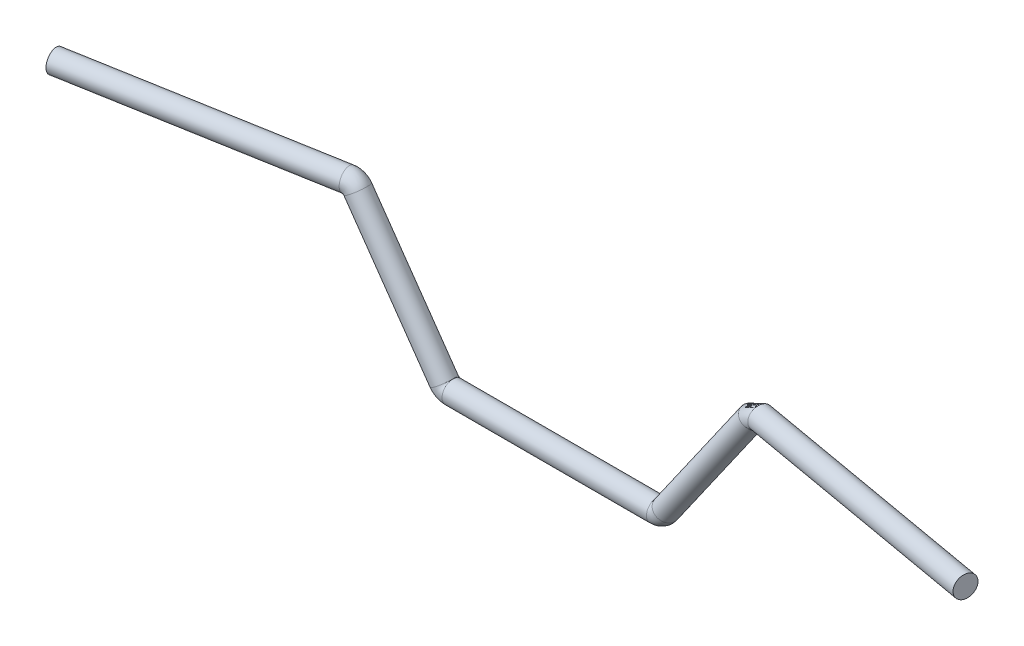
from build123d import *

# Parameters (mm, degrees)
SWEEP4_PROFILE_R = 10


with BuildPart() as part:
    # Sweep4: sweep along a curve in space
    with BuildLine() as sweep4_path:
        Line((191.229564546, 122.872806643, 0.915683484), (422.390326176, 122.872806643, 41.67556264))
        ThreePointArc((183.011875869, 118.553245059, 0), (186.611803821, 121.726761627, 0.242944677), (191.229564546, 122.872806643, 0.915683484))
        Line((102.985849937, 4.264235636, 0), (183.011875869, 118.553245059, 0))
        ThreePointArc((102.985849937, 4.264235636, 0), (99.411815627, 1.129891668, 0), (94.794329494, 0, 0))
        Line((-94.794329494, 0, 0), (94.794329494, 0, 0))
        ThreePointArc((-94.794329494, 0, 0), (-99.411815627, 1.129891668, 0), (-102.985849937, 4.264235636, 0))
        Line((-102.985849937, 4.264235636, 0), (-183.011875869, 118.553245059, 0))
        ThreePointArc((-183.011875869, 118.553245059, 0), (-186.611803821, 121.726761627, 0.242944677), (-191.229564546, 122.872806643, 0.915683484))
        Line((-191.229564546, 122.872806643, 0.915683484), (-422.390326176, 122.872806643, 41.67556264))
    # Sweep4 profile (on start of the path) → Sweep4 (sweep)
    with BuildSketch(Plane(origin=(-422.390326176, 122.872806643, 41.67556264), x_dir=(0.17364817766693033, 0, 0.9848077530122081), z_dir=(0.9848077530122081, 0, -0.17364817766693033))):
        Circle(SWEEP4_PROFILE_R)
    sweep(path=sweep4_path.line)


solid = part.part
